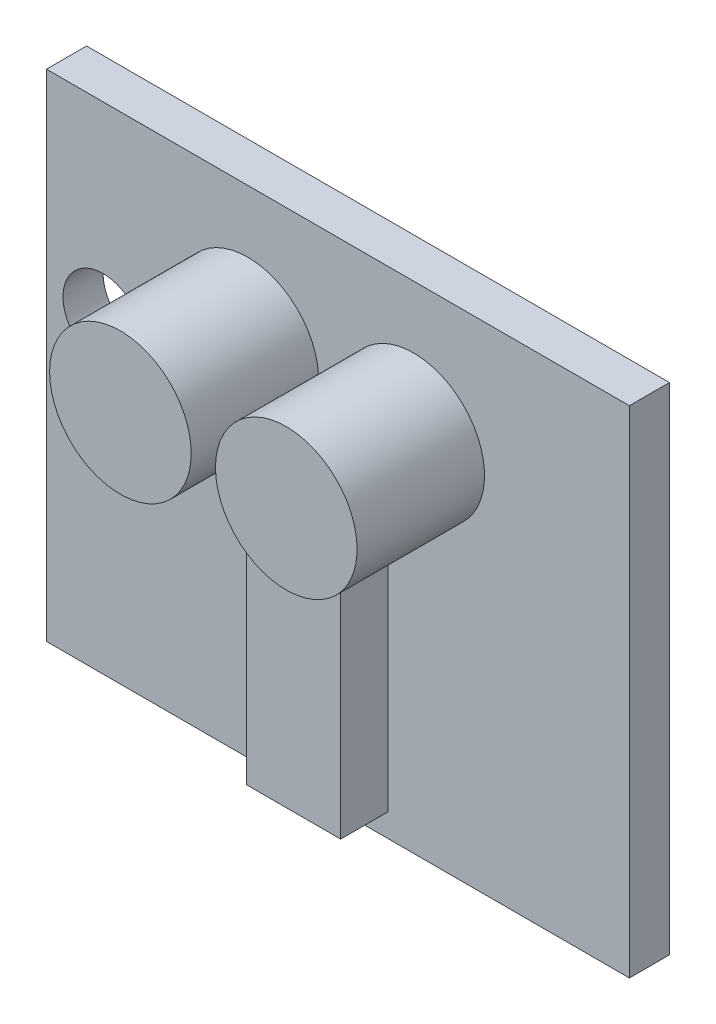
from build123d import *

# Parameters (mm, degrees)
SKETCH_1_W      = 24.7
SKETCH_1_H      = 21
SKETCH_1_R      = 1.7
EXTRUDE_1_DEPTH = 1.7
SKETCH_2_R      = 3
EXTRUDE_2_DEPTH = 5.4
SKETCH_3_W      = 4
SKETCH_3_H      = 10
EXTRUDE_3_DEPTH = 2


with BuildPart() as part:
    # Эскиз1 → Бобышка-Вытянуть1 (new body)
    with BuildSketch(Plane.XY):
        with Locations((-24.007558734, 119.994849308)):
            Rectangle(SKETCH_1_W, SKETCH_1_H)
        with Locations((-33.957558734, 122.494849308)):
            Circle(SKETCH_1_R, mode=Mode.SUBTRACT)
    extrude(amount=EXTRUDE_1_DEPTH)

    # Эскиз2 → Бобышка-Вытянуть2 (add)
    with BuildSketch(Plane.XY.offset(1.7)):
        with Locations(Location((-27.825017342, 124.86066732, 0), (0, 0, 180))):
            Circle(SKETCH_2_R)
        with Locations(Location((-20.796714073, 124.86066732, 0), (0, 0, 180))):
            Circle(SKETCH_2_R)
    extrude(amount=EXTRUDE_2_DEPTH)

    # Эскиз3 → Бобышка-Вытянуть3 (add)
    with BuildSketch(Plane.XY.offset(1.7)):
        with Locations((-23.892041325, 115.47395964)):
            Rectangle(SKETCH_3_W, SKETCH_3_H)
    extrude(amount=EXTRUDE_3_DEPTH)


solid = part.part
